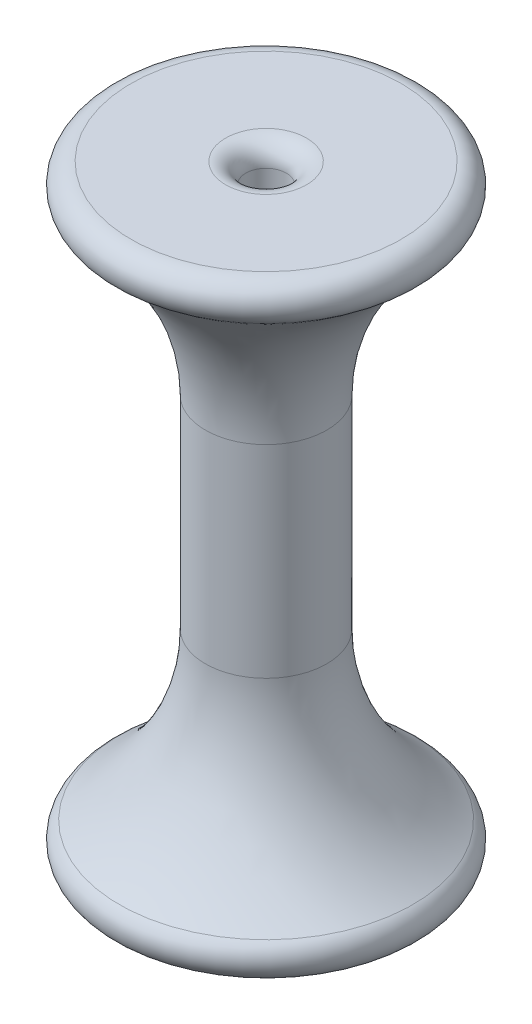
from build123d import *


with BuildPart() as part:
    # 草图4 → 旋转1 (revolve)
    with BuildSketch(Plane.XY, mode=Mode.PRIVATE) as revolve_1_sk:
        with BuildLine():
            Line((-6.67544468, 15), (-2, 15))
            ThreePointArc((-2, 15), (-1.292893219, 14.707106781), (-1, 14))
            Line((-1, 14), (-1, -14))
            ThreePointArc((-1, -14), (-1.292893219, -14.707106781), (-2, -15))
            Line((-2, -15), (-6.67544468, -15))
            ThreePointArc((-6.67544468, -15), (-7.628907269, -14.301511345), (-7.250404254, -13.181818182))
            ThreePointArc((-7.250404254, -13.181818182), (-4.125994212, -9.609991461), (-3, -5))
            Line((-3, -5), (-3, 5))
            ThreePointArc((-3, 5), (-4.125994212, 9.609991461), (-7.250404254, 13.181818182))
            ThreePointArc((-7.250404254, 13.181818182), (-7.628907269, 14.301511345), (-6.67544468, 15))
        make_face()
    revolve(revolve_1_sk.sketch.rotate(Axis((0, 0, 0), (0, 1, 0)), 270), axis=Axis((0, 0, 0), (0, 1, 0)))


solid = part.part
